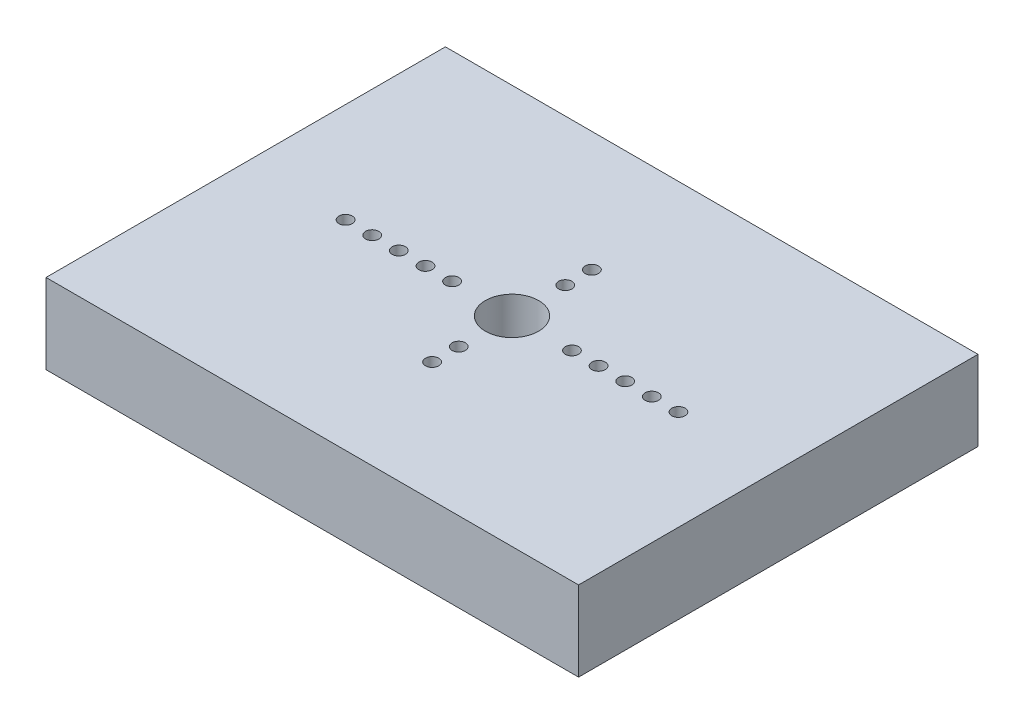
from build123d import *

# Parameters (mm, degrees)
SKETCH1_W           = 40
SKETCH1_H           = 30
BOSS_EXTRUDE1_DEPTH = 3
SKETCH2_W           = 40
SKETCH2_H           = 30
SKETCH2_R           = 2
SKETCH2_R_2         = 0.5
BOSS_EXTRUDE2_DEPTH = 3


with BuildPart() as part:
    # Sketch1 → Boss-Extrude1 (new body)
    with BuildSketch(Plane(origin=(0, 0, 0), x_dir=(1, 0, 0), z_dir=(0, 1, 0))):
        Rectangle(SKETCH1_W, SKETCH1_H)
        Polygon((-2.55, -2.55), (-2.55, -7.85), (2.55, -7.85), (2.55, -2.55), (14.5, -2.55), (14.5, 2.55), (2.55, 2.55), (2.55, 7.85), (-2.55, 7.85), (-2.55, 2.55), (-14.5, 2.55), (-14.5, -2.55), align=None, mode=Mode.SUBTRACT)
    extrude(amount=BOSS_EXTRUDE1_DEPTH)

    # Sketch2 → Boss-Extrude2 (add)
    with BuildSketch(Plane(origin=(0, 3, 0), x_dir=(1, 0, 0), z_dir=(0, 1, 0))):
        Rectangle(SKETCH2_W, SKETCH2_H)
        with Locations(Location((0, 0, 0), (0, 0, 270))):
            Circle(SKETCH2_R, mode=Mode.SUBTRACT)
        with Locations(Location((-4.5, 0, 0), (0, 0, 270))):
            Circle(SKETCH2_R_2, mode=Mode.SUBTRACT)
        with Locations(Location((-6.5, 0, 0), (0, 0, 270))):
            Circle(SKETCH2_R_2, mode=Mode.SUBTRACT)
        with Locations(Location((-8.5, 0, 0), (0, 0, 270))):
            Circle(SKETCH2_R_2, mode=Mode.SUBTRACT)
        with Locations(Location((-10.5, 0, 0), (0, 0, 270))):
            Circle(SKETCH2_R_2, mode=Mode.SUBTRACT)
        with Locations(Location((-12.5, 0, 0), (0, 0, 270))):
            Circle(SKETCH2_R_2, mode=Mode.SUBTRACT)
        with Locations(Location((0, 4, 0), (0, 0, 270))):
            Circle(SKETCH2_R_2, mode=Mode.SUBTRACT)
        with Locations(Location((0, 6, 0), (0, 0, 270))):
            Circle(SKETCH2_R_2, mode=Mode.SUBTRACT)
        with Locations(Location((12.5, 0, 0), (0, 0, 90))):
            Circle(SKETCH2_R_2, mode=Mode.SUBTRACT)
        with Locations(Location((10.5, 0, 0), (0, 0, 90))):
            Circle(SKETCH2_R_2, mode=Mode.SUBTRACT)
        with Locations(Location((8.5, 0, 0), (0, 0, 90))):
            Circle(SKETCH2_R_2, mode=Mode.SUBTRACT)
        with Locations(Location((6.5, 0, 0), (0, 0, 90))):
            Circle(SKETCH2_R_2, mode=Mode.SUBTRACT)
        with Locations(Location((4.5, 0, 0), (0, 0, 90))):
            Circle(SKETCH2_R_2, mode=Mode.SUBTRACT)
        with Locations(Location((0, -4, 0), (0, 0, 90))):
            Circle(SKETCH2_R_2, mode=Mode.SUBTRACT)
        with Locations(Location((0, -6, 0), (0, 0, 90))):
            Circle(SKETCH2_R_2, mode=Mode.SUBTRACT)
    extrude(amount=BOSS_EXTRUDE2_DEPTH)


solid = part.part
